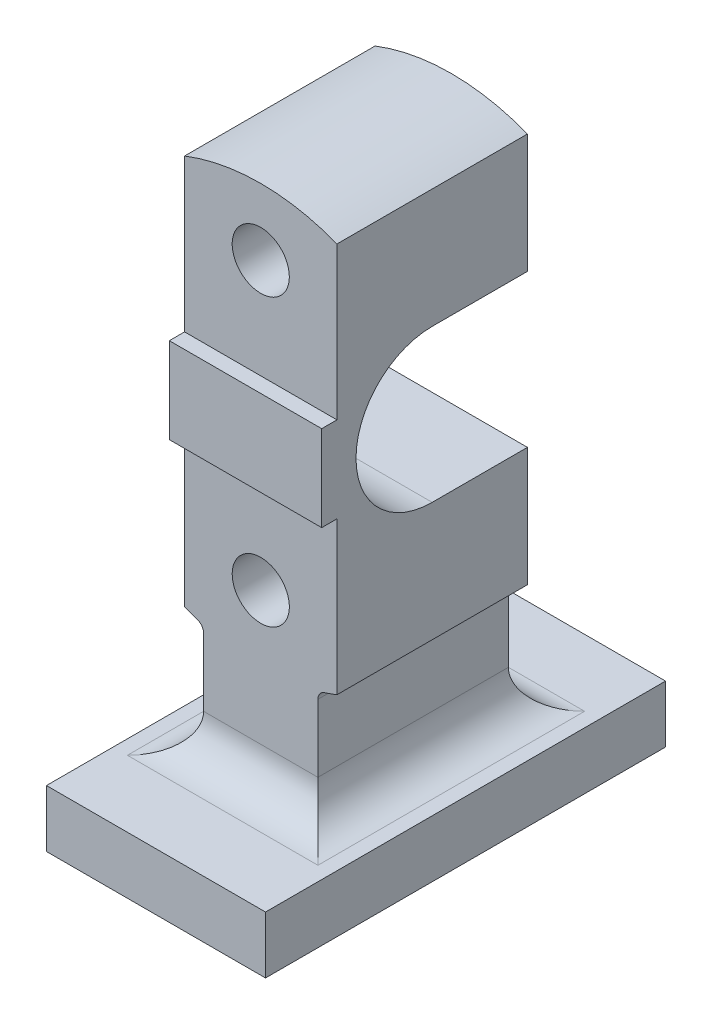
from build123d import *

# Parameters (mm, degrees)
SKETCH1_R           = 15
BOSS_EXTRUDE1_DEPTH = 100
BOSS_EXTRUDE2_START = -50
SKETCH2_W           = 115
SKETCH2_H           = 30
BOSS_EXTRUDE2_DEPTH = 105
FILLET1_R           = 20
SKETCH3_W           = 80
SKETCH3_H           = 45
BOSS_EXTRUDE3_DEPTH = 8
CUT_EXTRUDE1_DEPTH  = 268.5


with BuildPart() as part:
    # Sketch1 → Boss-Extrude1 (new body)
    with BuildSketch(Plane.XY):
        with BuildLine():
            Line((-40, 102.46950766), (-40, -102.46950766))
            ThreePointArc((-40, -102.46950766), (-36.757315886, -103.676900652), (-33.47826087, -104.781706653))
            ThreePointArc((-33.47826087, -104.781706653), (-30.962135735, -106.595672378), (-30, -109.544511501))
            Line((-30, -109.544511501), (-30, -165))
            Line((-30, -165), (30, -165))
            Line((30, -165), (30, -109.544511501))
            ThreePointArc((30, -109.544511501), (30.962135735, -106.595672378), (33.47826087, -104.781706653))
            ThreePointArc((33.47826087, -104.781706653), (36.757315886, -103.676900652), (40, -102.46950766))
            Line((40, -102.46950766), (40, 102.46950766))
            ThreePointArc((40, 102.46950766), (0, 110), (-40, 102.46950766))
        make_face()
        with Locations((0, 75)):
            Circle(SKETCH1_R, mode=Mode.SUBTRACT)
        with Locations(Location((0, -75, 0), (0, 0, 180))):
            Circle(SKETCH1_R, mode=Mode.SUBTRACT)
    extrude(amount=BOSS_EXTRUDE1_DEPTH)

    # Sketch2 → Boss-Extrude2 (add, symmetric)
    with BuildSketch(Plane.XY.offset(100).offset(BOSS_EXTRUDE2_START)):
        with Locations((0, -180)):
            Rectangle(SKETCH2_W, SKETCH2_H)
    extrude(amount=BOSS_EXTRUDE2_DEPTH, both=True)

    # Fillet1
    fillet1_edges = [part.edges().sort_by_distance(p)[0] for p in [
        (0, -165, 0),
        (0, -165, 100),
        (30, -165, 50),
        (-30, -165, 50),
    ]]
    fillet(fillet1_edges, radius=FILLET1_R)

    # Sketch3 → Boss-Extrude3 (add)
    with BuildSketch(Plane.XY.offset(100)):
        Rectangle(SKETCH3_W, SKETCH3_H)
    extrude(amount=BOSS_EXTRUDE3_DEPTH)

    # Sketch4 → Cut-Extrude1 (cut, through all)
    with BuildSketch(Plane.ZY.offset(40)):
        with BuildLine():
            Line((-70, -40), (50, -40))
            ThreePointArc((50, -40), (90, 0), (50, 40))
            Line((50, 40), (-70, 40))
            Line((-70, 40), (-70, -40))
        make_face()
    extrude(amount=-CUT_EXTRUDE1_DEPTH, mode=Mode.SUBTRACT)


solid = part.part
